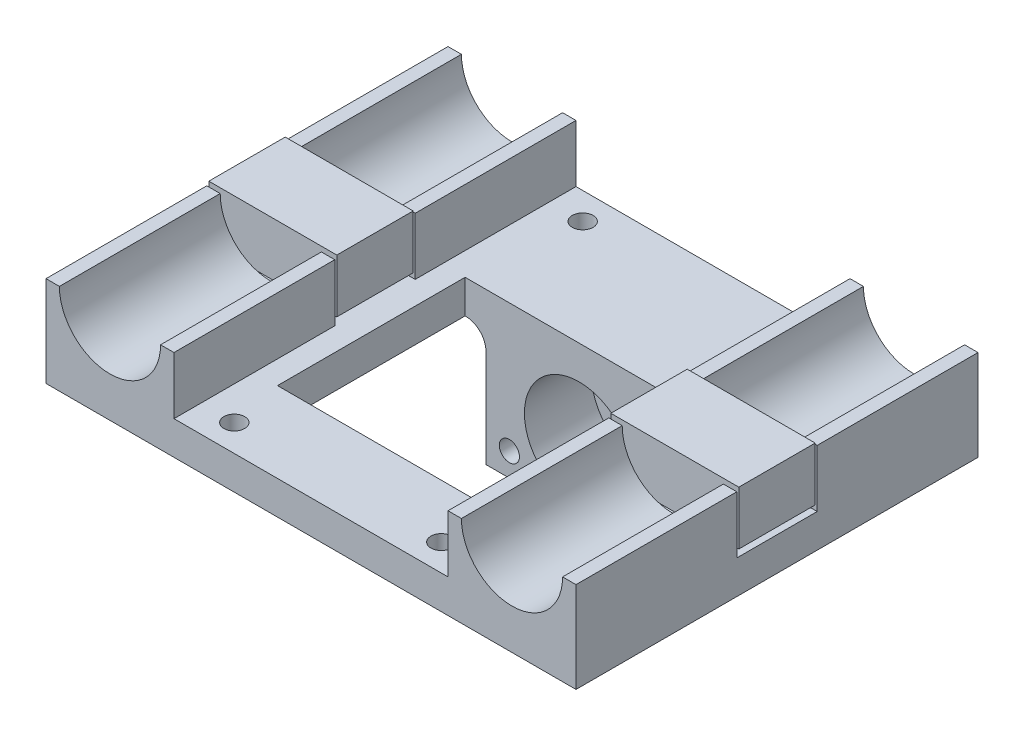
from build123d import *

# Parameters (mm, degrees)
SKETCH1_W             = 79.1
SKETCH1_H             = 60
BOSS_EXTRUDE1_DEPTH   = 5
BOSS_EXTRUDE2_DEPTH   = 24
MIRROR2_COPY_1_DEPTH  = 24
SKETCH10_R            = 1.55
CUT_EXTRUDE7_DEPTH    = 8
SKETCH11_R            = 3
CUT_EXTRUDE8_DEPTH    = 1
SKETCH12_W            = 27.78460969
SKETCH12_H            = 17.653
SKETCH12_R            = 1.5
SKETCH12_R_2          = 8.15
BOSS_EXTRUDE5_DEPTH   = 10
SKETCH13_W            = 34
SKETCH13_H            = 28
CUT_EXTRUDE9_DEPTH    = 10
FILLET2_R             = 3
SKETCH15_W            = 6
SKETCH15_H            = 2.8
CUT_EXTRUDE12_DEPTH   = 8.2
SKETCH17_W            = 19.1
SKETCH17_H            = 11.4
BOSS_EXTRUDE6_DEPTH   = 8
BOSS_EXTRUDE6_2_DEPTH = 8
SKETCH18_W            = 27.78460969
SKETCH18_H            = 9.370460502
BOSS_EXTRUDE7_DEPTH   = 16.653


with BuildPart() as part:
    # Sketch1 → Boss-Extrude1 (new body)
    with BuildSketch(Plane(origin=(0, 0, 0), x_dir=(1, 0, 0), z_dir=(0, 1, 0))):
        Rectangle(SKETCH1_W, SKETCH1_H)
    extrude(amount=BOSS_EXTRUDE1_DEPTH)

    # Sketch2 → Boss-Extrude2 (add)
    with BuildSketch(Plane.XY.offset(30)):
        with BuildLine():
            Line((-39.55, 13.55), (-39.55, 5))
            Line((-39.55, 5), (-20.45, 5))
            Line((-20.45, 5), (-20.45, 13.55))
            Line((-20.45, 13.55), (-22.45, 13.55))
            ThreePointArc((-22.45, 13.55), (-30, 6), (-37.55, 13.55))
            Line((-37.55, 13.55), (-39.55, 13.55))
        make_face()
    boss_extrude2 = extrude(amount=-BOSS_EXTRUDE2_DEPTH)

    # Mirror1: Boss-Extrude2 across plane
    add(boss_extrude2.mirror(Plane.XY))

    # Mirror2: Boss-Extrude2 across plane
    add(boss_extrude2.mirror(Plane(origin=(0, 0, 0), x_dir=(0, 0, 1), z_dir=(1, 0, 0))))

    # Mirror2 copy 1 sketch → Mirror2 copy 1 (add)
    with BuildSketch(Plane(origin=(0, 0, -30), x_dir=(-1, 0, 0), z_dir=(0, 0, -1))):
        with BuildLine():
            Line((-39.55, 13.55), (-39.55, 5))
            Line((-39.55, 5), (-20.45, 5))
            Line((-20.45, 5), (-20.45, 13.55))
            Line((-20.45, 13.55), (-22.45, 13.55))
            ThreePointArc((-22.45, 13.55), (-30, 6), (-37.55, 13.55))
            Line((-37.55, 13.55), (-39.55, 13.55))
        make_face()
    extrude(amount=-MIRROR2_COPY_1_DEPTH)

    # Sketch10 → Cut-Extrude7 (cut)
    with BuildSketch(Plane(origin=(0, 5, 0), x_dir=(1, 0, 0), z_dir=(0, 1, 0))):
        with Locations(Location((-15.45, -26, 0), (0, 0, 270))):
            Circle(SKETCH10_R)
        with Locations(Location((-15.45, 26, 0), (0, 0, 270))):
            Circle(SKETCH10_R)
        with Locations(Location((15.45, 26, 0), (0, 0, 270))):
            Circle(SKETCH10_R)
        with Locations(Location((15.45, -26, 0), (0, 0, 270))):
            Circle(SKETCH10_R)
    extrude(amount=-CUT_EXTRUDE7_DEPTH, mode=Mode.SUBTRACT)

    # Sketch11 → Cut-Extrude8 (cut)
    with BuildSketch(Plane.XZ):
        with Locations(Location((-15.45, 26, 0), (0, 0, 270))):
            Circle(SKETCH11_R)
        with Locations(Location((15.45, 26, 0), (0, 0, 270))):
            Circle(SKETCH11_R)
        with Locations(Location((15.45, -26, 0), (0, 0, 270))):
            Circle(SKETCH11_R)
        with Locations(Location((-15.45, -26, 0), (0, 0, 270))):
            Circle(SKETCH11_R)
    extrude(amount=-CUT_EXTRUDE8_DEPTH, mode=Mode.SUBTRACT)

    # Sketch12 → Boss-Extrude5 (add)
    with BuildSketch(Plane.XY.offset(-10)):
        with Locations((0, -8.8265)):
            Rectangle(SKETCH12_W, SKETCH12_H)
        with Locations(Location((-10.392304845, -14.153, 0), (0, 0, 180))):
            Circle(SKETCH12_R, mode=Mode.SUBTRACT)
        with Locations(Location((10.392304845, -14.153, 0), (0, 0, 180))):
            Circle(SKETCH12_R, mode=Mode.SUBTRACT)
        with Locations(Location((0, -8.153, 0), (0, 0, 180))):
            Circle(SKETCH12_R_2, mode=Mode.SUBTRACT)
    extrude(amount=-BOSS_EXTRUDE5_DEPTH)

    # Sketch13 → Cut-Extrude9 (cut)
    with BuildSketch(Plane.XZ):
        with Locations((0, 4)):
            Rectangle(SKETCH13_W, SKETCH13_H)
    extrude(amount=-CUT_EXTRUDE9_DEPTH, mode=Mode.SUBTRACT)

    # Fillet2
    fillet2_edges = [part.edges().sort_by_distance(p)[0] for p in [
        (-13.892304845, 0, -15),
        (13.892304845, 0, -15),
    ]]
    fillet(fillet2_edges, radius=FILLET2_R)

    # Sketch15 → Cut-Extrude12 (cut)
    with BuildSketch(Plane(origin=(-15.772652423, -15.772652423, 0), x_dir=(-0.7071067811865477, 0.7071067811865475, 0), z_dir=(-0.7071067811865475, -0.7071067811865477, 0))):
        with Locations((-2.659213046, 13.9)):
            Rectangle(SKETCH15_W, SKETCH15_H)
    cut_extrude12 = extrude(amount=-CUT_EXTRUDE12_DEPTH, mode=Mode.SUBTRACT)

    # Mirror3: Cut-Extrude12 across plane
    add(cut_extrude12.mirror(Plane(origin=(0, 0, 0), x_dir=(0, 0, 1), z_dir=(1, 0, 0))), mode=Mode.SUBTRACT)


with BuildPart() as body_2:
    # Sketch17 → Boss-Extrude6 (new body)
    with BuildSketch(Plane(origin=(0, 6, 0), x_dir=(1, 0, 0), z_dir=(0, 1, 0))):
        with Locations((-30, 0)):
            Rectangle(SKETCH17_W, SKETCH17_H)
    extrude(amount=BOSS_EXTRUDE6_DEPTH)


with BuildPart() as body_3:
    # Sketch17 → Boss-Extrude6 2 (new body)
    with BuildSketch(Plane(origin=(0, 6, 0), x_dir=(1, 0, 0), z_dir=(0, 1, 0))):
        with Locations((30, 0)):
            Rectangle(SKETCH17_W, SKETCH17_H)
    extrude(amount=BOSS_EXTRUDE6_2_DEPTH)


with BuildPart() as body_4:
    # Sketch18 → Boss-Extrude7 (new body)
    with BuildSketch(Plane(origin=(0, -1, 0), x_dir=(-1, 0, 0), z_dir=(0, -1, 0))):
        with Locations((0, 25.285230251)):
            Rectangle(SKETCH18_W, SKETCH18_H)
    extrude(amount=BOSS_EXTRUDE7_DEPTH)


solid = Compound([part.part, body_2.part, body_3.part, body_4.part])
